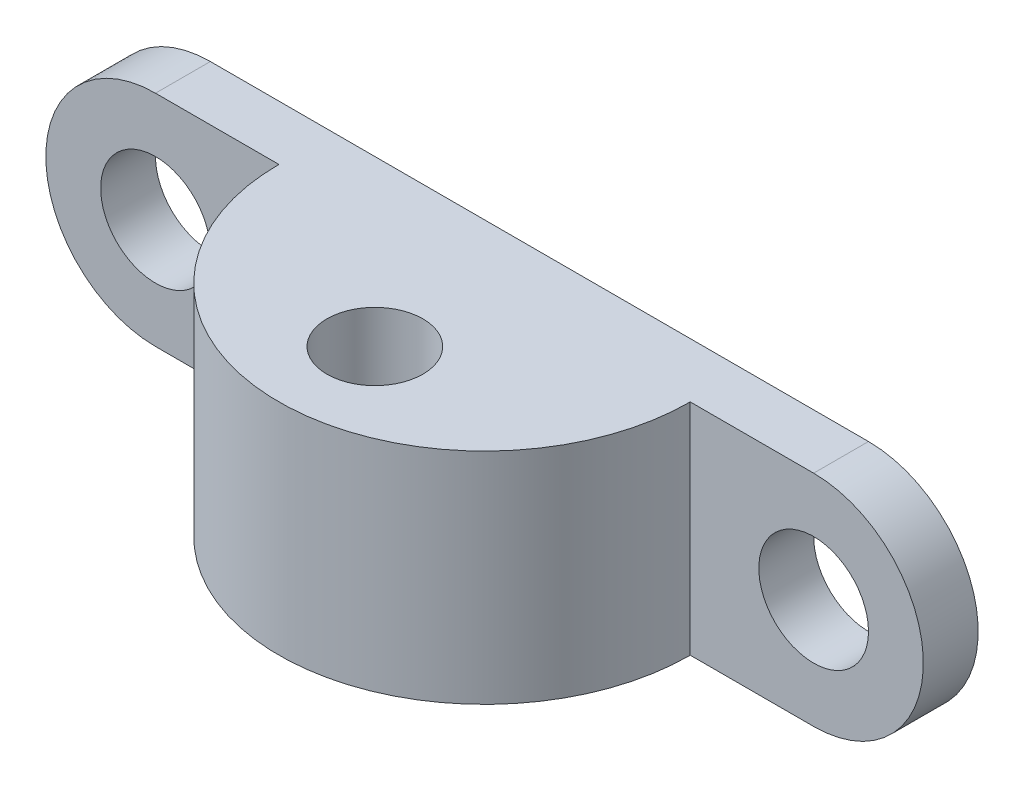
from build123d import *

# Parameters (mm, degrees)
BOSS_EXTRUDE1_DEPTH = 2
SKETCH2_R           = 1.75
BOSS_EXTRUDE2_DEPTH = 8
SKETCH6_R           = 2
CUT_EXTRUDE1_DEPTH  = 30.261749777


with BuildPart() as part:
    # Sketch1 → Boss-Extrude1 (new body)
    with BuildSketch(Plane.XY):
        with BuildLine():
            ThreePointArc((4, 0), (2.828427125, 2.828427125), (0, 4))
            Line((0, 4), (0, -4))
            ThreePointArc((0, -4), (2.828427125, -2.828427125), (4, 0))
        make_face()
        with BuildLine():
            Line((0, -4), (0, 4))
            ThreePointArc((0, 4), (-4, 0), (0, -4))
        make_face()
        with BuildLine():
            ThreePointArc((4, 0), (2.828427125, 2.828427125), (0, 4))
            Line((0, 4), (0, -4))
            ThreePointArc((0, -4), (2.828427125, -2.828427125), (4, 0))
        make_face()
        with BuildLine():
            Line((0, -4), (0, 4))
            ThreePointArc((0, 4), (-4, 0), (0, -4))
        make_face()
        with BuildLine():
            Line((24, 4), (0, 4))
            ThreePointArc((0, 4), (2.828427125, 2.828427125), (4, 0))
            ThreePointArc((4, 0), (2.828427125, -2.828427125), (0, -4))
            Line((0, -4), (24, -4))
            ThreePointArc((24, -4), (20, 0), (24, 4))
        make_face()
        with BuildLine():
            ThreePointArc((28, 0), (26.828427125, 2.828427125), (24, 4))
            Line((24, 4), (24, -4))
            ThreePointArc((24, -4), (26.828427125, -2.828427125), (28, 0))
        make_face()
        with BuildLine():
            Line((24, -4), (24, 4))
            ThreePointArc((24, 4), (20, 0), (24, -4))
        make_face()
        with BuildLine():
            ThreePointArc((28, 0), (26.828427125, 2.828427125), (24, 4))
            Line((24, 4), (24, -4))
            ThreePointArc((24, -4), (26.828427125, -2.828427125), (28, 0))
        make_face()
        with BuildLine():
            Line((24, -4), (24, 4))
            ThreePointArc((24, 4), (20, 0), (24, -4))
        make_face()
    extrude(amount=BOSS_EXTRUDE1_DEPTH)

    # Sketch2 → Boss-Extrude2 (add)
    with BuildSketch(Plane.XZ.offset(4)):
        with BuildLine():
            Line((4.5, 2), (19.5, 2))
            ThreePointArc((19.5, 2), (12, 9.5), (4.5, 2))
        make_face()
        with Locations(Location((12, 6, 0), (0, 0, 270))):
            Circle(SKETCH2_R, mode=Mode.SUBTRACT)
    extrude(amount=-BOSS_EXTRUDE2_DEPTH)

    # Sketch6 → Cut-Extrude1 (cut, through all)
    with BuildSketch(Plane.XY.offset(2)):
        Circle(SKETCH6_R)
        with Locations((24, 0)):
            Circle(SKETCH6_R)
    extrude(amount=-CUT_EXTRUDE1_DEPTH, mode=Mode.SUBTRACT)


solid = part.part
